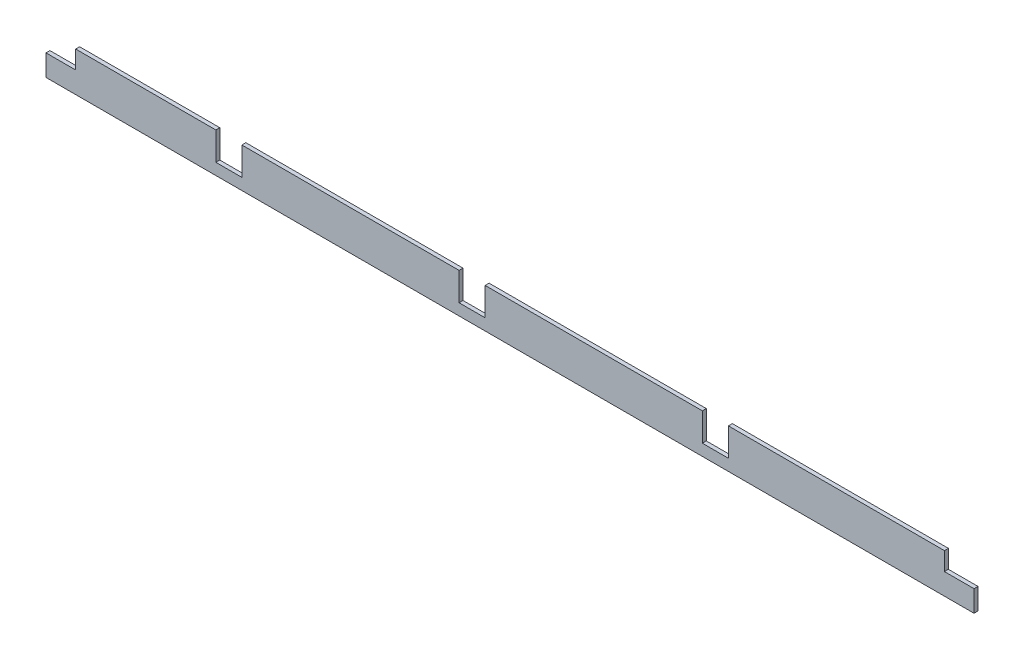
from build123d import *

# Parameters (mm, degrees)
BOSS_EXTRUDE1_DEPTH = 1.27


with BuildPart() as part:
    # Sketch1 → Boss-Extrude1 (new body)
    with BuildSketch(Plane.XY):
        Polygon((62.992, 12.7), (132.842, 12.7), (132.842, 3.683), (141.224, 3.683), (141.224, 12.7), (211.074, 12.7), (211.074, 3.683), (219.456, 3.683), (219.456, 12.7), (288.925, 12.7), (288.925, 6.858), (298.45, 6.858), (298.45, 0), (0, 0), (0, 6.858), (9.525, 6.858), (9.525, 12.7), (54.61, 12.7), (54.61, 3.683), (62.992, 3.683), align=None)
    extrude(amount=BOSS_EXTRUDE1_DEPTH)


solid = part.part
